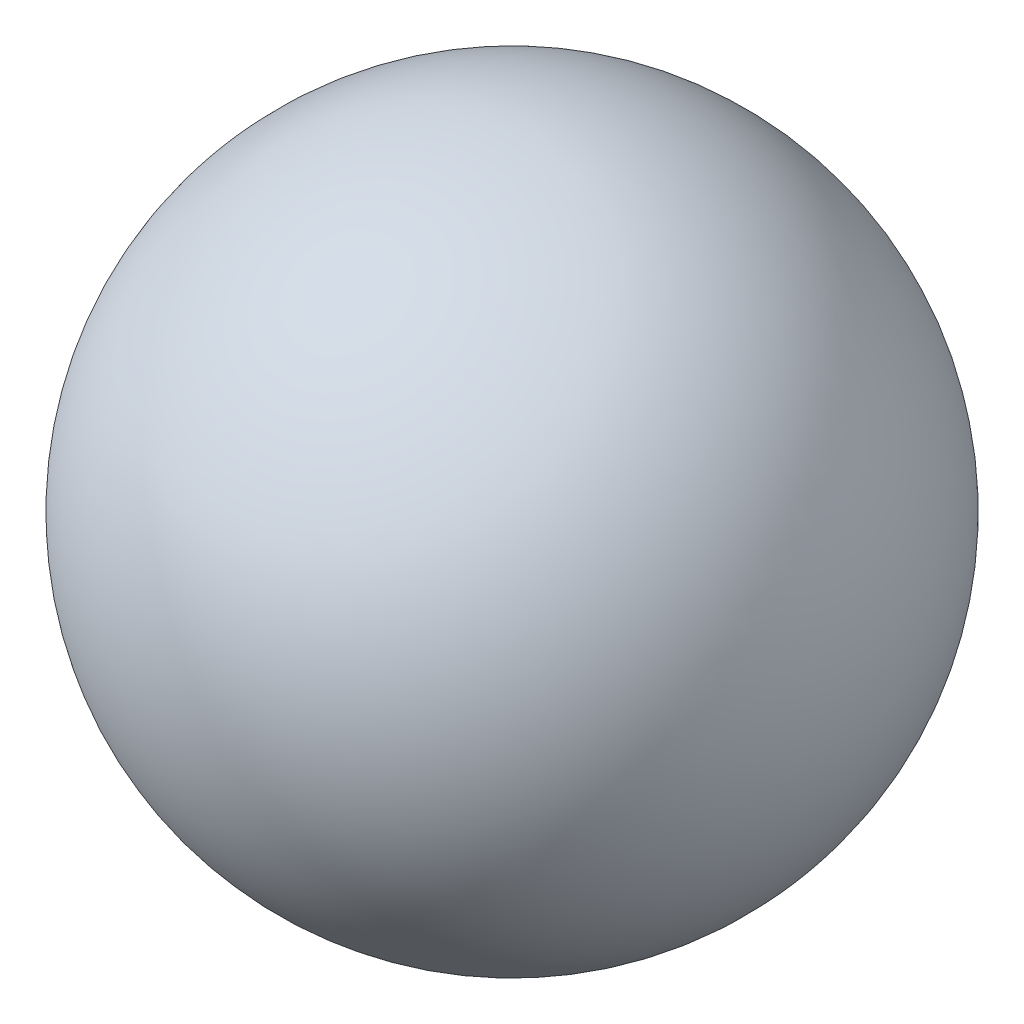
from build123d import *


with BuildPart() as part:
    # Sketch1 → Revolve1 (revolve)
    with BuildSketch(Plane.XY):
        with BuildLine():
            Line((2.779932675, -1.604994878), (4.094143968, -2.363755122))
            ThreePointArc((4.094143968, -2.363755122), (3.816418443, -1.327269354), (2.779932675, -1.604994878))
        make_face()
    revolve(axis=Axis((3.108485498, -1.794684939, 0), (0.8660254037844362, -0.5000000000000044, 0)))


solid = part.part
